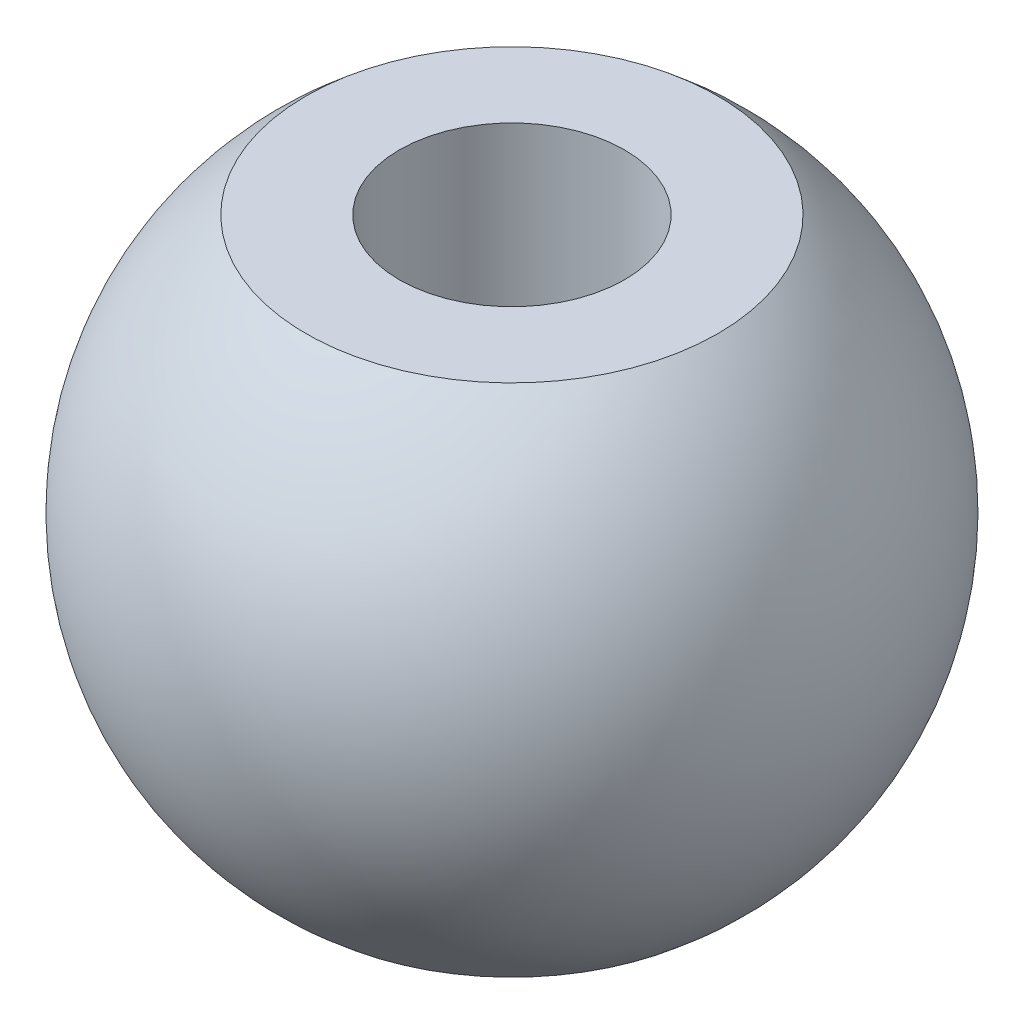
from build123d import *

# Parameters (mm, degrees)
SKETCH2_R          = 1.75
CUT_EXTRUDE1_DEPTH = 11.792590051


with BuildPart() as part:
    # Sketch1 → Revolve2 (revolve)
    with BuildSketch(Plane.XY):
        with BuildLine():
            Line((0, 4), (0, -4))
            Line((0, -4), (-3.2, -4))
            ThreePointArc((-3.2, -4), (-5.12249939, 0), (-3.2, 4))
            Line((-3.2, 4), (0, 4))
        make_face()
    revolve(axis=Axis((0, 4, 0), (0, -1, 0)))

    # Sketch2 → Cut-Extrude1 (cut, through all)
    with BuildSketch(Plane(origin=(0, 4, 0), x_dir=(1, 0, 0), z_dir=(0, 1, 0))):
        with Locations(Location((0, 0, 0), (0, 0, 270))):
            Circle(SKETCH2_R)
    extrude(amount=-CUT_EXTRUDE1_DEPTH, mode=Mode.SUBTRACT)


solid = part.part
